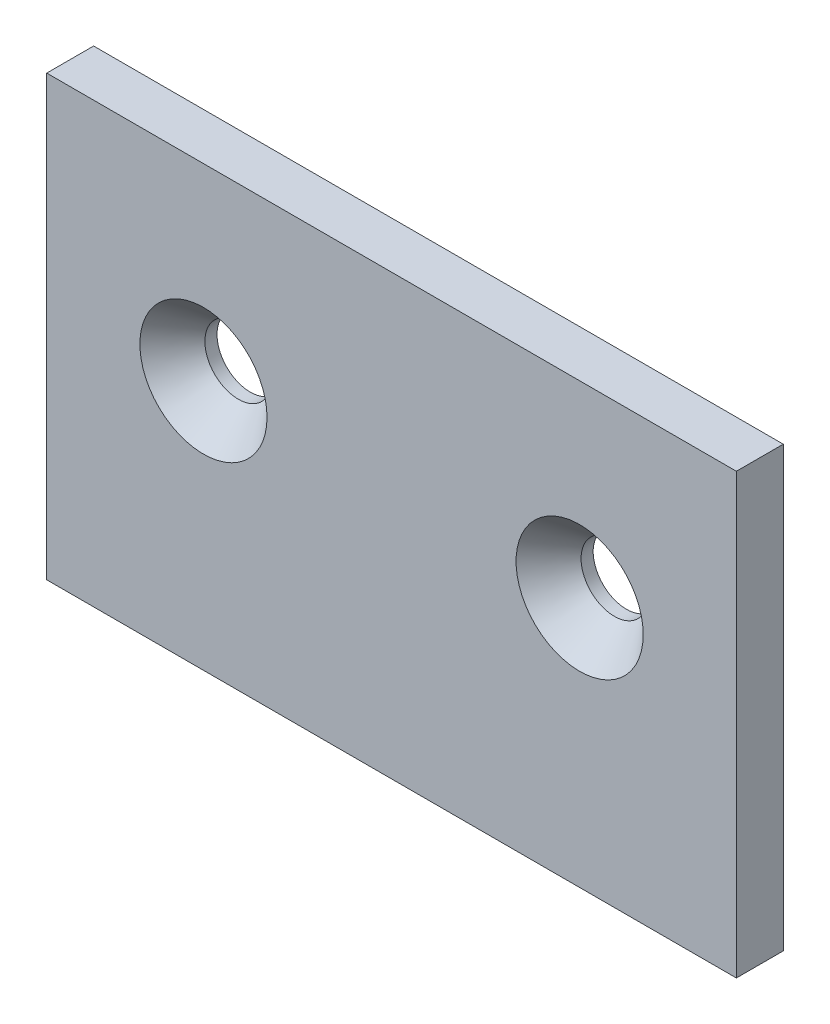
from build123d import *

# Parameters (mm, degrees)
SKETCH1_W           = 69.85
SKETCH1_H           = 44.45
BOSS_EXTRUDE1_DEPTH = 2.375


with BuildPart() as part:
    # Sketch1 → Boss-Extrude1 (new, symmetric)
    with BuildSketch(Plane.XY):
        Rectangle(SKETCH1_W, SKETCH1_H)
    extrude(amount=BOSS_EXTRUDE1_DEPTH, both=True)

    # Sketch4 → CSK for 1/4 Flat Head Machine Screw1 (revolve, cut)
    with BuildSketch(Plane(origin=(-19.05, 3.175, 2.375), x_dir=(0, -1, 0), z_dir=(1, 0, 0))):
        Polygon((0, 0), (0, 4.75), (3.3782, 4.75), (3.3782, 3.520932584), (6.4389, 0), align=None)
    csk_for_1_4_flat_head_machine_screw1 = revolve(axis=Axis((-19.05, 3.175, 8.725), (0, 0, -1)), mode=Mode.SUBTRACT)

    # Mirror1: CSK for 1/4 Flat Head Machine Screw1 across plane
    add(csk_for_1_4_flat_head_machine_screw1.mirror(Plane(origin=(0, 0, 0), x_dir=(0, 0, 1), z_dir=(1, 0, 0))), mode=Mode.SUBTRACT)


solid = part.part
